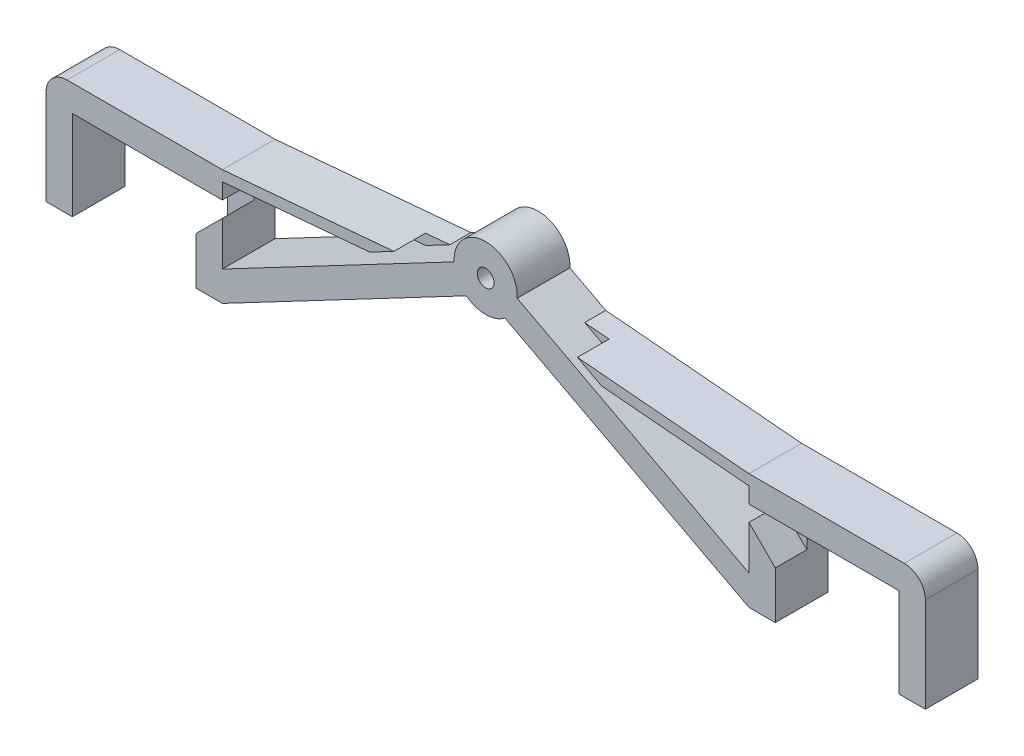
from build123d import *

# Parameters (mm, degrees)
SKETCH1_R           = 8
BOSS_EXTRUDE1_DEPTH = 25
CUT_EXTRUDE1_START  = 85
SKETCH2_R           = 5.25
CUT_EXTRUDE1_DEPTH  = 30
FILLET1_R           = 20
BOSS_EXTRUDE2_DEPTH = 50
CUT_EXTRUDE2_DEPTH  = 30
SKETCH5_R           = 20.5
CUT_EXTRUDE3_DEPTH  = 5


with BuildPart() as part:
    # Sketch1 → Boss-Extrude1 (new, symmetric)
    with BuildSketch(Plane.XY):
        with BuildLine():
            Line((25, 85), (25, 0))
            Line((25, 0), (0, 0))
            Line((0, 0), (0, 110))
            Line((0, 110), (167.5, 110))
            Line((167.5, 110), (167.5, 28.258760447))
            Line((167.5, 28.258760447), (387.545711729, 144.215139733))
            ThreePointArc((387.545711729, 144.215139733), (417.5, 175.870619777), (447.454288271, 144.215139733))
            Line((447.454288271, 144.215139733), (667.5, 28.258760447))
            Line((667.5, 28.258760447), (667.5, 110))
            Line((667.5, 110), (835, 110))
            Line((835, 110), (835, 0))
            Line((835, 0), (810, 0))
            Line((810, 0), (810, 85))
            Line((810, 85), (692.5, 85))
            Line((692.5, 85), (692.5, 0))
            Line((692.5, 0), (667.5, 0))
            Line((667.5, 0), (435.799385732, 122.098104516))
            ThreePointArc((435.799385732, 122.098104516), (417.5, 115.870619777), (399.200614268, 122.098104516))
            Line((399.200614268, 122.098104516), (167.5, 0))
            Line((167.5, 0), (142.5, 0))
            Line((142.5, 0), (142.5, 85))
            Line((142.5, 85), (25, 85))
        make_face()
        with Locations((417.5, 145.870619777)):
            Circle(SKETCH1_R, mode=Mode.SUBTRACT)
    extrude(amount=BOSS_EXTRUDE1_DEPTH, both=True)

    # Sketch2 → Cut-Extrude1 (cut)
    with BuildSketch(Plane.XZ.offset(-85).offset(CUT_EXTRUDE1_START)):
        with Locations(Location((16.275, 0, 0), (0, 0, 90))):
            Circle(SKETCH2_R)
        with Locations(Location((151.225, 0, 0), (0, 0, 90))):
            Circle(SKETCH2_R)
        with Locations(Location((683.775, 0, 0), (0, 0, 90))):
            Circle(SKETCH2_R)
        with Locations(Location((818.725, 0, 0), (0, 0, 90))):
            Circle(SKETCH2_R)
    extrude(amount=-CUT_EXTRUDE1_DEPTH, mode=Mode.SUBTRACT)

    # Fillet1
    fillet1_edges = [part.edges().sort_by_distance(p)[0] for p in [
        (0, 110, 0),
        (835, 110, 0),
    ]]
    fillet(fillet1_edges, radius=FILLET1_R)

    # Sketch3 → Boss-Extrude2 (add)
    with BuildSketch(Plane.XY.offset(25)):
        Polygon((353.496925298, 126.272622414), (167.5, 110), (167.5, 99.961801625), (330.655651498, 114.236071521), align=None)
        Polygon((667.5, 110), (481.503074702, 126.272622414), (504.344348502, 114.236071521), (667.5, 99.961801625), align=None)
    extrude(amount=-BOSS_EXTRUDE2_DEPTH)

    # Sketch4 → Cut-Extrude2 (cut)
    with BuildSketch(Plane.XY.offset(25)):
        Polygon((142.5, 85), (167.5, 85), (167.5, 70), (142.5, 45), align=None)
        Polygon((330.655651498, 114.236071521), (353.496925298, 126.272622414), (330.348569212, 124.247403677), (307.507295412, 112.210852784), align=None)
        Polygon((527.492704588, 112.210852784), (504.344348502, 114.236071521), (481.503074702, 126.272622414), (504.651430788, 124.247403677), align=None)
        Polygon((692.5, 45), (692.5, 85), (667.5, 85), (667.5, 70), align=None)
    extrude(amount=-CUT_EXTRUDE2_DEPTH, mode=Mode.SUBTRACT)

    # Sketch5 → Cut-Extrude3 (cut)
    with BuildSketch(Plane(origin=(0, 0, -25), x_dir=(-1, 0, 0), z_dir=(0, 0, -1))):
        with Locations((-417.5, 145.870619777)):
            Circle(SKETCH5_R)
    extrude(amount=-CUT_EXTRUDE3_DEPTH, mode=Mode.SUBTRACT)


solid = part.part
